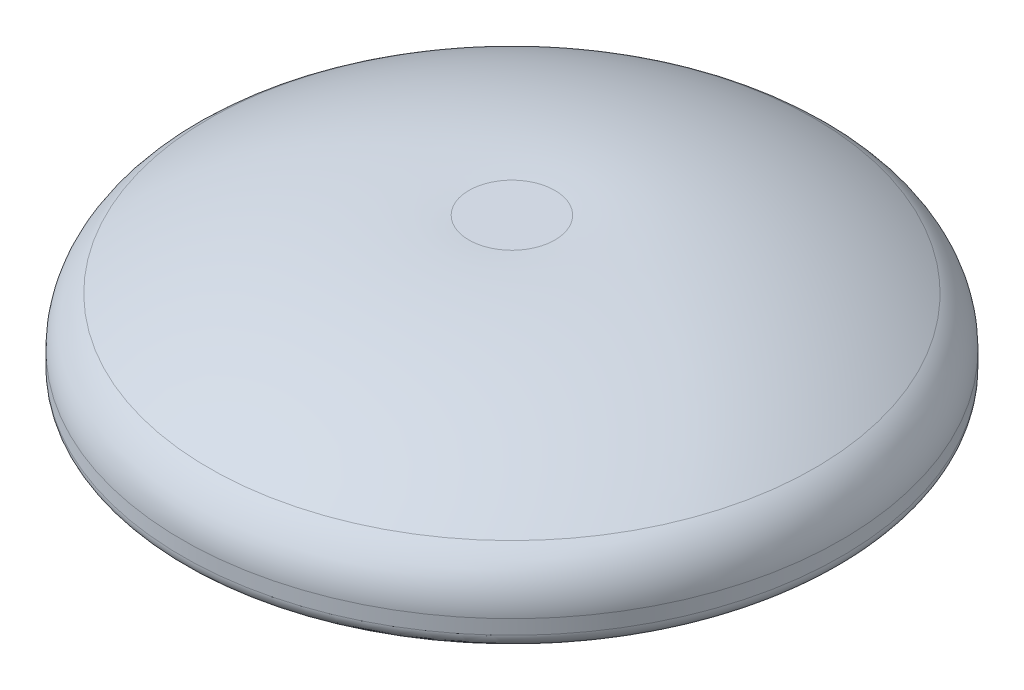
from build123d import *

# Parameters (mm, degrees)
FILLET1_R     = 1.5
CHAMFER1_SIZE = 0.5


with BuildPart() as part:
    # Sketch1 → Revolve1 (revolve)
    with BuildSketch(Plane.XY, mode=Mode.PRIVATE) as revolve1_sk:
        with BuildLine():
            Line((-11.000013874, -2.81e-07), (-1, -2.81e-07))
            Line((-1, -2.81e-07), (-1, -5.000000281))
            Line((-1, -5.000000281), (0, -5.000000281))
            Line((0, -5.000000281), (0, 5.06243))
            Line((0, 5.06243), (-1.5, 5.06243))
            ThreePointArc((-1.5, 5.06243), (-6.215053401, 4.581844183), (-10.565043576, 2.700281861))
            ThreePointArc((-10.565043576, 2.700281861), (-11.252524354, 1.971118503), (-11.499986126, 0.999999718))
            Line((-11.499986126, 0.999999718), (-11.5, 0.499999719))
            ThreePointArc((-11.5, 0.499999719), (-11.353562359, 0.14644717), (-11.000013874, -2.81e-07))
        make_face()
    revolve(revolve1_sk.sketch.rotate(Axis((0, 0, 0), (0, 1, 0)), 270), axis=Axis((0, 0, 0), (0, 1, 0)))

    # Fillet1
    fillet1_edges = [part.edges().sort_by_distance(p)[0] for p in [
        (0, -2.813517580805419e-07, 1.0),
    ]]
    fillet(fillet1_edges, radius=FILLET1_R)

    # Chamfer1
    chamfer1_edges = [part.edges().sort_by_distance(p)[0] for p in [
        (0, -5.000000281, 1),
    ]]
    chamfer(chamfer1_edges, length=CHAMFER1_SIZE)


solid = part.part
